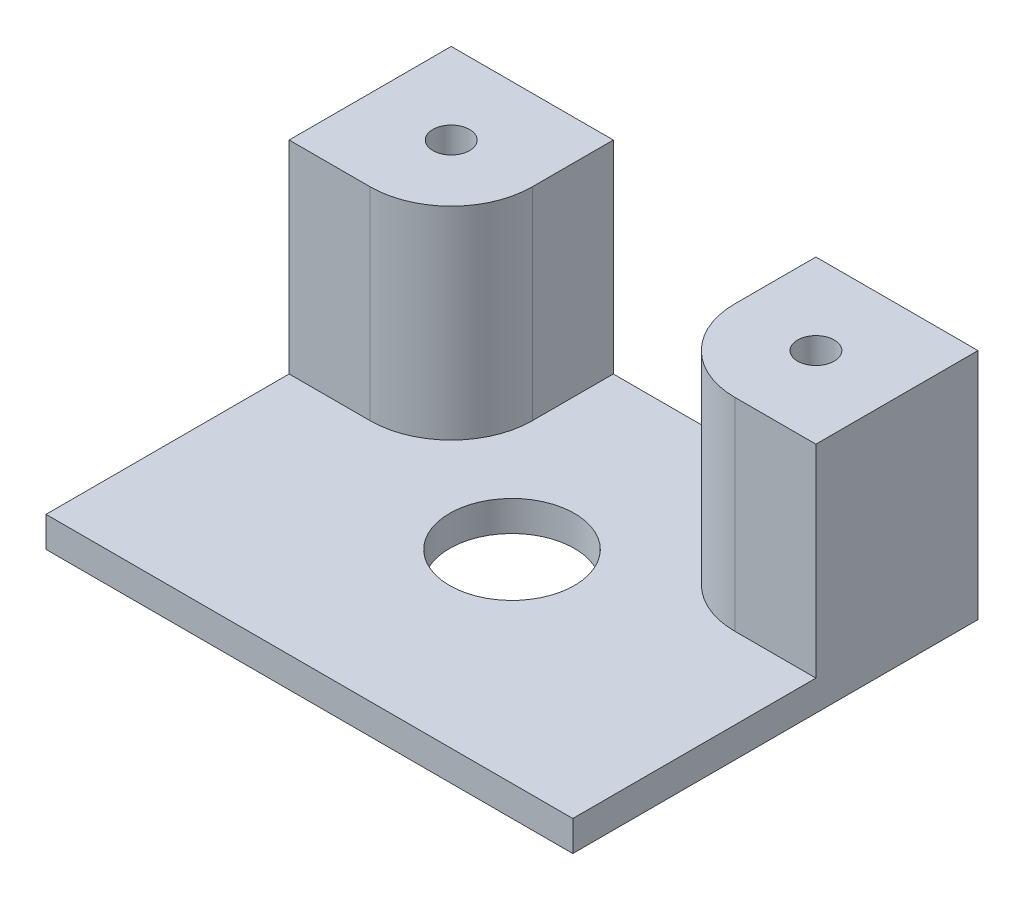
from build123d import *

# Parameters (mm, degrees)
SKETCH1_W                   = 165.1
SKETCH1_H                   = 127
BOSS_EXTRUDE1_DEPTH         = 9.525
SKETCH2_R                   = 19.579444904
CUT_EXTRUDE1_DEPTH          = 209.513154561
BOSS_EXTRUDE3_DEPTH         = 63.5
F_1_2_20_TAPPED_HOLE1_D     = 11.50874
F_1_2_20_TAPPED_HOLE1_DEPTH = 31.75
F_1_2_20_TAPPED_HOLE1_TIP   = 3.45757432


with BuildPart() as part:
    # Sketch1 → Boss-Extrude1 (new body)
    with BuildSketch(Plane(origin=(0, 0, 0), x_dir=(1, 0, 0), z_dir=(0, 1, 0))):
        with Locations((82.55, 63.5)):
            Rectangle(SKETCH1_W, SKETCH1_H)
    extrude(amount=BOSS_EXTRUDE1_DEPTH)

    # Sketch2 → Cut-Extrude1 (cut, through all)
    with BuildSketch(Plane(origin=(0, 9.525, 0), x_dir=(1, 0, 0), z_dir=(0, 1, 0))):
        with Locations(Location((82.55, 63.5, 0), (0, 0, 270))):
            Circle(SKETCH2_R)
    extrude(amount=-CUT_EXTRUDE1_DEPTH, mode=Mode.SUBTRACT)

    # Sketch3 → Boss-Extrude3 (add)
    with BuildSketch(Plane(origin=(0, 9.525, 0), x_dir=(1, 0, 0), z_dir=(0, 1, 0))):
        with BuildLine():
            Line((0, 127), (50.8, 127))
            Line((50.8, 127), (50.8, 101.6))
            ThreePointArc((50.8, 101.6), (43.360512242, 83.639487758), (25.4, 76.2))
            Line((25.4, 76.2), (0, 76.2))
            Line((0, 76.2), (0, 127))
        make_face()
        with BuildLine():
            Line((165.1, 127), (114.3, 127))
            Line((114.3, 127), (114.3, 101.6))
            ThreePointArc((114.3, 101.6), (121.739487758, 83.639487758), (139.7, 76.2))
            Line((139.7, 76.2), (165.1, 76.2))
            Line((165.1, 76.2), (165.1, 127))
        make_face()
    extrude(amount=BOSS_EXTRUDE3_DEPTH)

    # 1/2-20 Tapped Hole1
    with Locations(Plane(origin=(25.4, 73.025, -101.6), x_dir=(0, 0, 1), z_dir=(0, 1, 0))):
        with Locations((0, 0), (0, 114.3)):
            Hole(F_1_2_20_TAPPED_HOLE1_D / 2, depth=F_1_2_20_TAPPED_HOLE1_DEPTH)
            with Locations((0, 0, -(F_1_2_20_TAPPED_HOLE1_DEPTH + F_1_2_20_TAPPED_HOLE1_TIP / 2))):  # 118° drill point
                Cone(0, F_1_2_20_TAPPED_HOLE1_D / 2, F_1_2_20_TAPPED_HOLE1_TIP, mode=Mode.SUBTRACT)


solid = part.part
